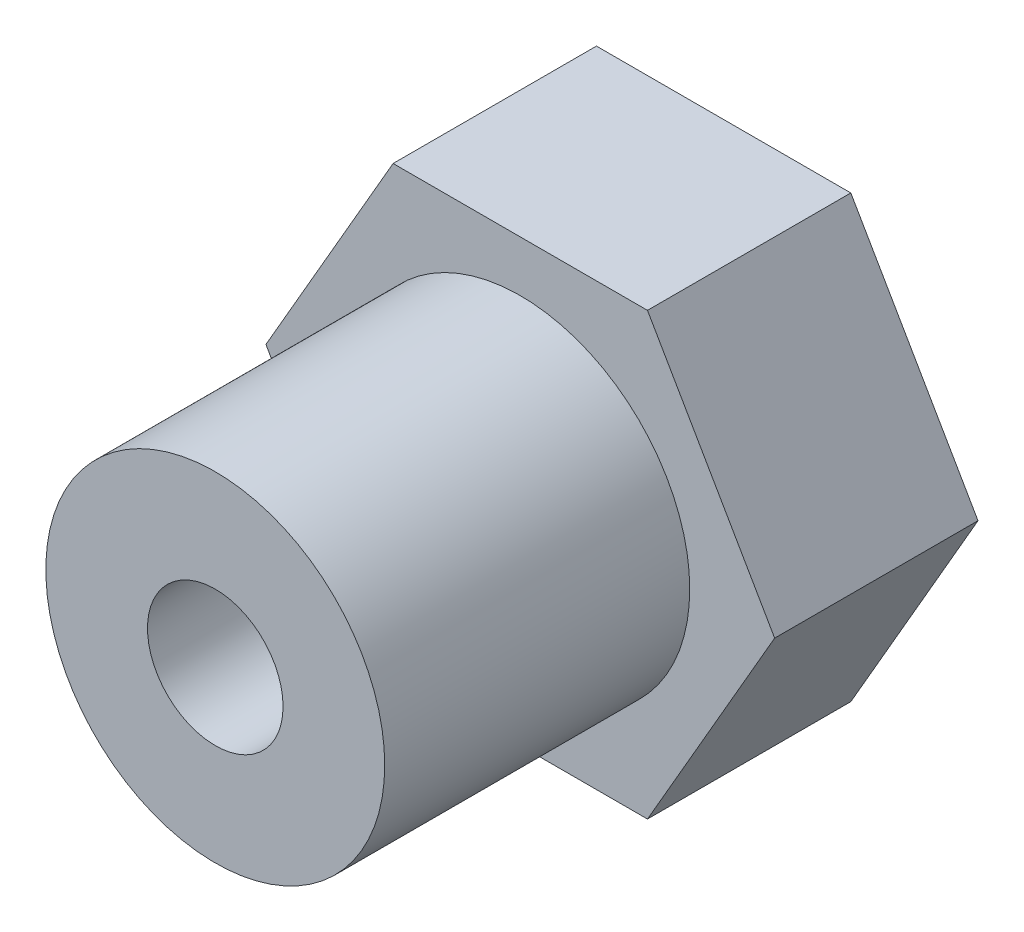
from build123d import *

# Parameters (mm, degrees)
SKETCH2_R           = 2
BOSS_EXTRUDE1_DEPTH = 6
BOSS_EXTRUDE2_START = 9
SKETCH2_3_R         = 5
SKETCH2_3_R_2       = 2
BOSS_EXTRUDE2_DEPTH = 9


with BuildPart() as part:
    # Sketch2 → Boss-Extrude1 (new body)
    with BuildSketch(Plane.XY):
        Polygon((3.75277675, -6.5), (7.505553499, 0), (3.75277675, 6.5), (-3.75277675, 6.5), (-7.505553499, 0), (-3.75277675, -6.5), align=None)
        Circle(SKETCH2_R, mode=Mode.SUBTRACT)
    extrude(amount=-BOSS_EXTRUDE1_DEPTH)

    # Sketch2<3> → Boss-Extrude2 (add)
    with BuildSketch(Plane.XY.offset(BOSS_EXTRUDE2_START)):
        Circle(SKETCH2_3_R)
        Circle(SKETCH2_3_R_2, mode=Mode.SUBTRACT)
    extrude(amount=-BOSS_EXTRUDE2_DEPTH)


solid = part.part
